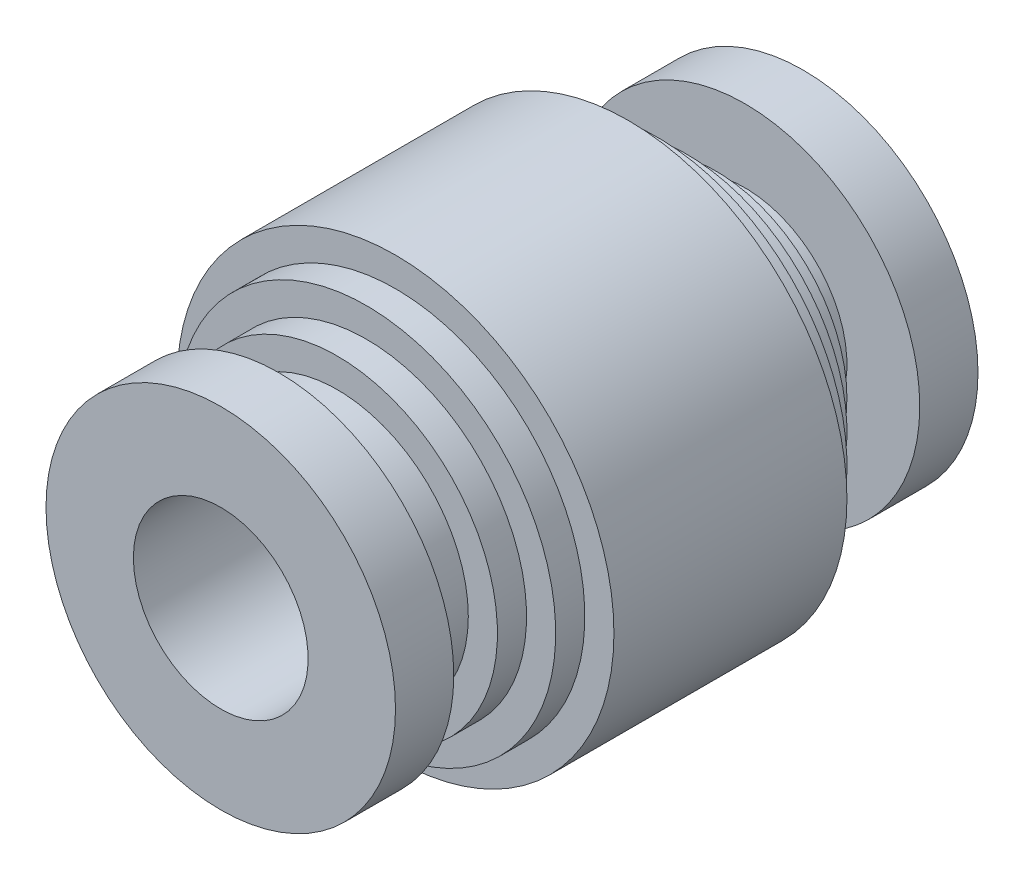
from build123d import *


with BuildPart() as part:
    # Эскиз1 → Повернуть1 (revolve)
    with BuildSketch(Plane(origin=(0, 0, 0), x_dir=(1, 0, 0), z_dir=(0, 1, 0)), mode=Mode.PRIVATE) as revolve_1_sk:
        Polygon((5.5, 5), (5.5, 6), (4.5, 6), (4.5, 7), (3.5, 7), (3.5, 8), (6, 8), (6, 10), (3, 10), (3, -10), (6, -10), (6, -8), (3.5, -8), (3.5, -7), (4.5, -7), (4.5, -6), (5.5, -6), (5.5, -5), (6.5, -5), (6.5, -4), (7.5, -4), (7.5, 4), (6.5, 4), (6.5, 5), align=None)
    revolve(revolve_1_sk.sketch.rotate(Axis((0, 0, -10), (0, 0, 1)), 180), axis=Axis((0, 0, -10), (0, 0, 1)))


solid = part.part
